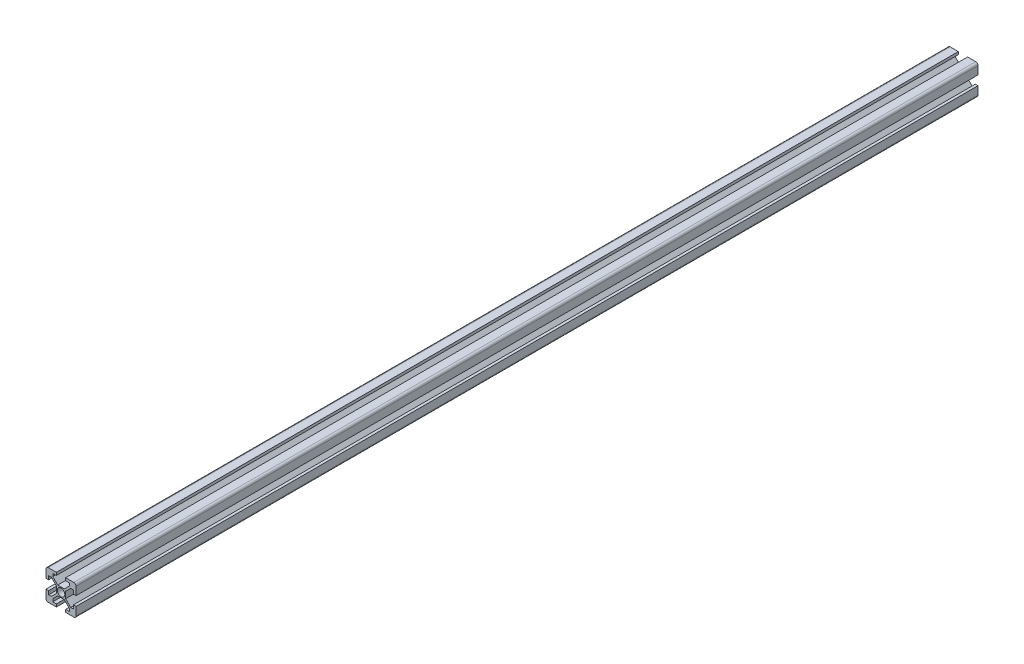
from build123d import *

# Parameters (mm, degrees)
SKETCH_1_R      = 2.5
EXTRUDE_1_DEPTH = 600


with BuildPart() as part:
    # 草图1 → 凸台-拉伸1 (new body)
    with BuildSketch(Plane.XY):
        with BuildLine():
            Line((-8.2, -3.1), (-10, -3.1))
            Line((-10, -3.1), (-10, -8.5))
            ThreePointArc((-10, -8.5), (-9.560660172, -9.560660172), (-8.5, -10))
            Line((-8.5, -10), (-3.1, -10))
            Line((-3.1, -10), (-3.1, -8.2))
            Line((-3.1, -8.2), (-5.5, -8.2))
            Line((-5.5, -8.2), (-5.5, -6.397050155))
            Line((-5.5, -6.397050155), (-2.202949845, -3.1))
            Line((-2.202949845, -3.1), (2.202949845, -3.1))
            Line((2.202949845, -3.1), (5.5, -6.397050155))
            Line((5.5, -6.397050155), (5.5, -8.2))
            Line((5.5, -8.2), (3.1, -8.2))
            Line((3.1, -8.2), (3.1, -10))
            Line((3.1, -10), (8.5, -10))
            ThreePointArc((8.5, -10), (9.560660172, -9.560660172), (10, -8.5))
            Line((10, -8.5), (10, -3.1))
            Line((10, -3.1), (8.2, -3.1))
            Line((8.2, -3.1), (8.2, -5.5))
            Line((8.2, -5.5), (6.397050155, -5.5))
            Line((6.397050155, -5.5), (3.05412702, -2.157076865))
            Line((3.05412702, -2.157076865), (3.05412702, 2.157076865))
            Line((3.05412702, 2.157076865), (6.397050155, 5.5))
            Line((6.397050155, 5.5), (8.2, 5.5))
            Line((8.2, 5.5), (8.2, 3.1))
            Line((8.2, 3.1), (10, 3.1))
            Line((10, 3.1), (10, 8.5))
            ThreePointArc((10, 8.5), (9.560660172, 9.560660172), (8.5, 10))
            Line((8.5, 10), (3.1, 10))
            Line((3.1, 10), (3.1, 8.2))
            Line((3.1, 8.2), (5.5, 8.2))
            Line((5.5, 8.2), (5.5, 6.397050155))
            Line((5.5, 6.397050155), (2.202949845, 3.1))
            Line((2.202949845, 3.1), (-2.202949845, 3.1))
            Line((-2.202949845, 3.1), (-5.5, 6.397050155))
            Line((-5.5, 6.397050155), (-5.5, 8.2))
            Line((-5.5, 8.2), (-3.1, 8.2))
            Line((-3.1, 8.2), (-3.1, 10))
            Line((-3.1, 10), (-8.5, 10))
            ThreePointArc((-8.5, 10), (-9.560660172, 9.560660172), (-10, 8.5))
            Line((-10, 8.5), (-10, 3.1))
            Line((-10, 3.1), (-8.2, 3.1))
            Line((-8.2, 3.1), (-8.2, 5.5))
            Line((-8.2, 5.5), (-6.397050155, 5.5))
            Line((-6.397050155, 5.5), (-3.05412702, 2.157076865))
            Line((-3.05412702, 2.157076865), (-3.05412702, -2.157076865))
            Line((-3.05412702, -2.157076865), (-6.397050155, -5.5))
            Line((-6.397050155, -5.5), (-8.2, -5.5))
            Line((-8.2, -5.5), (-8.2, -3.1))
        make_face()
        Circle(SKETCH_1_R, mode=Mode.SUBTRACT)
    extrude(amount=EXTRUDE_1_DEPTH)


solid = part.part
